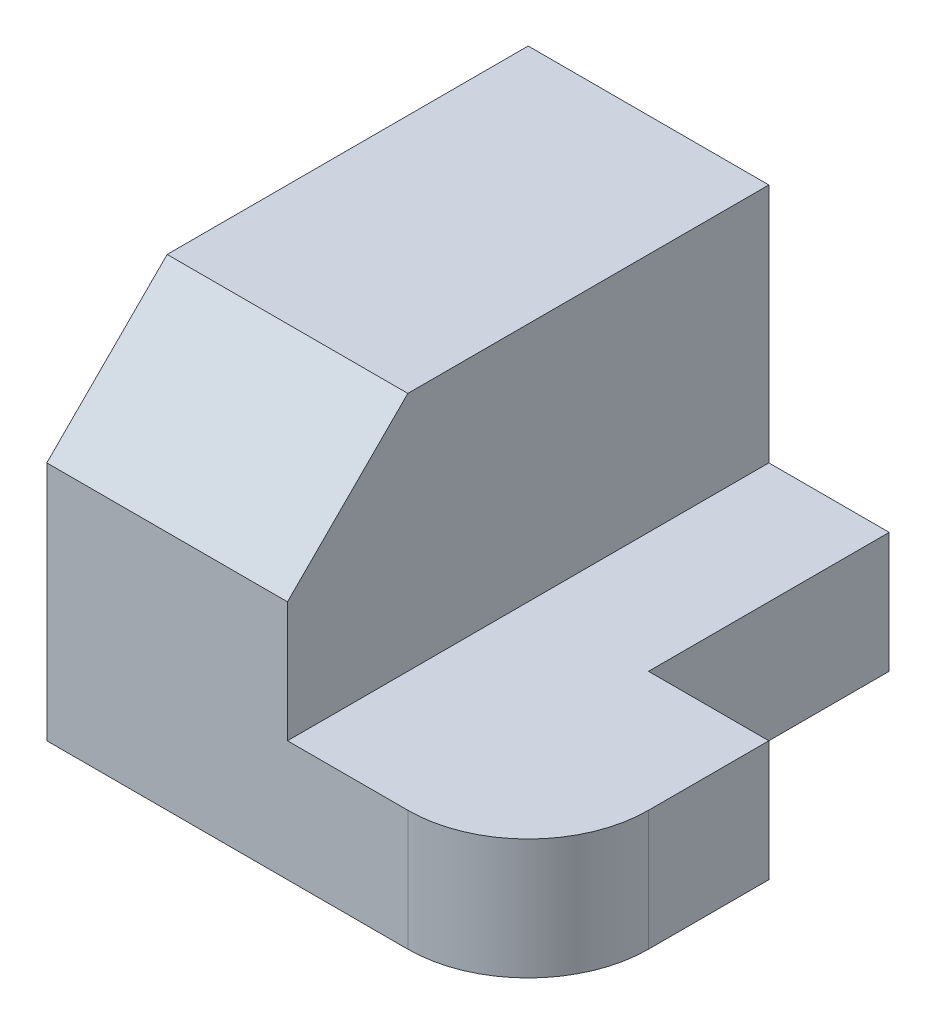
from build123d import *

# Parameters (mm, degrees)
EXTRUDE_1_DEPTH = 10
EXTRUDE_2_DEPTH = 5


with BuildPart() as part:
    # 草圖1 → 填料-伸長1 (new body)
    with BuildSketch(Plane(origin=(0, 0, 0), x_dir=(0, 0, -1), z_dir=(1, 0, 0))):
        Polygon((-20, 10), (-15, 15), (0, 15), (0, 0), (-20, 0), align=None)
    extrude(amount=EXTRUDE_1_DEPTH)

    # 草圖2 → 填料-伸長2 (add)
    with BuildSketch(Plane(origin=(0, 0, 0), x_dir=(1, 0, 0), z_dir=(0, 1, 0))):
        with BuildLine():
            Line((10, 0), (15, 0))
            Line((15, 0), (15, -10))
            Line((15, -10), (20, -10))
            Line((20, -10), (20, -15))
            ThreePointArc((20, -15), (18.535533906, -18.535533906), (15, -20))
            Line((15, -20), (10, -20))
            Line((10, -20), (10, -12.048813941))
            Line((10, -12.048813941), (10, 0))
        make_face()
    extrude(amount=EXTRUDE_2_DEPTH)


solid = part.part
